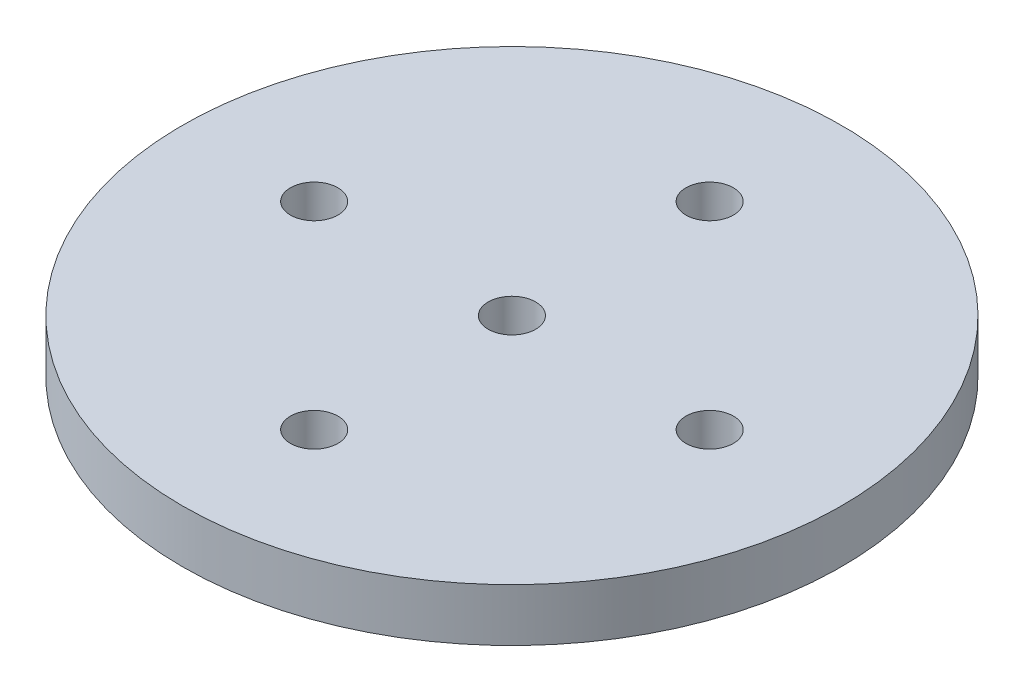
from build123d import *

# Parameters (mm, degrees)
CROQUIS1_R                     = 12.5
CROQUIS1_R_2                   = 4.5
CROQUIS1_R_3                   = 2.9
SALIENTE_EXTRUIR1_DEPTH        = 2
CROQUIS1_3_R                   = 4.5
CROQUIS1_3_R_2                 = 2.9
SALIENTE_EXTRUIR2_DEPTH        = 4
TALADRO_DE_MARGEN_PARA_M1_61_D = 1.8


with BuildPart() as part:
    # Croquis1 → Saliente-Extruir1 (new body)
    # profile 1 of 3: a face of its own
    with BuildSketch(Plane(origin=(0, 0, 0), x_dir=(1, 0, 0), z_dir=(0, 1, 0))):
        with Locations(Location((0, 0, 0), (0, 0, 270))):
            Circle(CROQUIS1_R)
        Circle(CROQUIS1_R_2, mode=Mode.SUBTRACT)
    # profile 2 of 3: a face of its own
    with BuildSketch(Plane(origin=(0, 0, 0), x_dir=(1, 0, 0), z_dir=(0, 1, 0))):
        Circle(CROQUIS1_R_2)
        Circle(CROQUIS1_R_3, mode=Mode.SUBTRACT)
    # profile 3 of 3: a face of its own
    with BuildSketch(Plane(origin=(0, 0, 0), x_dir=(1, 0, 0), z_dir=(0, 1, 0))):
        Circle(CROQUIS1_R_3)
    extrude(amount=SALIENTE_EXTRUIR1_DEPTH)

    # Croquis1<3> → Saliente-Extruir2 (add)
    with BuildSketch(Plane(origin=(0, 0, 0), x_dir=(1, 0, 0), z_dir=(0, 1, 0))):
        with Locations(Location((0, 0, 0), (0, 0, 270))):
            Circle(CROQUIS1_3_R)
        with Locations(Location((0, 0, 0), (0, 0, 270))):
            Circle(CROQUIS1_3_R_2, mode=Mode.SUBTRACT)
    extrude(amount=-SALIENTE_EXTRUIR2_DEPTH)

    # Taladro de margen para M1.61 (through all)
    with Locations(Plane.ZX.offset(2)):
        with Locations((0, 0), (-7.5, 0), (0, 7.5), (7.5, 0), (0, -7.5)):
            Hole(TALADRO_DE_MARGEN_PARA_M1_61_D / 2)


solid = part.part
